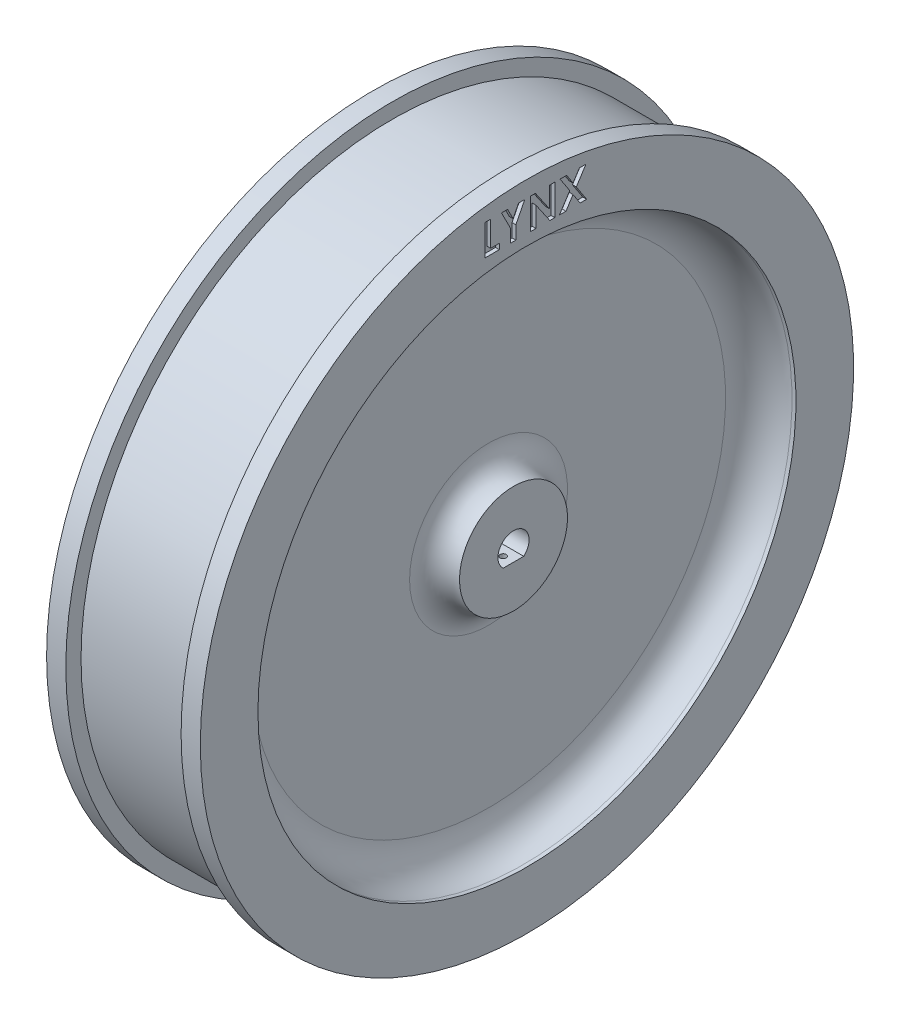
from build123d import *

# Parameters (mm, degrees)
BOSS_EXTRUDE2_DEPTH = 16
CUT_EXTRUDE2_DEPTH  = 1
SKETCH6_R           = 0.8
CUT_EXTRUDE4_DEPTH  = 20


with BuildPart() as part:
    # Sketch1 → Revolve2 (revolve)
    with BuildSketch(Plane.XY):
        with BuildLine():
            Line((8.97393545, 70), (10, 70))
            Line((10, 70), (10, 85))
            Line((10, 85), (5, 85))
            Line((5, 85), (5, 81.038856971))
            Line((5, 81.038856971), (-25, 81.038856971))
            Line((-25, 81.038856971), (-25, 85))
            Line((-25, 85), (-30, 85))
            Line((-30, 85), (-30, 70))
            add(Edge.make_bspline(
                [(-30, 70), (-18.635717154, 58.062094), (-15, 10)],
                knots=[0, 0, 0, 1, 1, 1], degree=2, weights=[1, 2.302666222, 1]))
            Line((-15, 10), (-15, 0))
            Line((-15, 0), (-9.5, 0))
            Line((-9.5, 0), (-9.5, 4.05))
            Line((-9.5, 4.05), (6.5, 4.05))
            Line((6.5, 4.05), (6.5, 14.05))
            Line((6.5, 14.05), (6.49, 14.05))
            ThreePointArc((6.49, 14.05), (1.90087699, 15.95087699), (0, 20.54))
            Line((0, 20.54), (0, 61.684457842))
            ThreePointArc((0, 61.684457842), (2.856751481, 67.601519544), (8.97393545, 70))
        make_face()
    revolve(axis=Axis((0, 0, 0), (1, 0, 0)))

    # Sketch2 → Boss-Extrude2 (add)
    with BuildSketch(Plane(origin=(6.5, 0, 0), x_dir=(0, 0, -1), z_dir=(1, 0, 0))):
        with BuildLine():
            Line((0, -3.05), (-2.664582519, -3.05))
            ThreePointArc((-2.664582519, -3.05), (0, -4.05), (2.664582519, -3.05))
            Line((2.664582519, -3.05), (0, -3.05))
        make_face()
    extrude(amount=-BOSS_EXTRUDE2_DEPTH)

    # Sketch5 → Cut-Extrude2 (cut)
    with BuildSketch(Plane(origin=(10, 0, 0), x_dir=(0, 0, -1), z_dir=(1, 0, 0))):
        Polygon((-10.885951739, 80.726758939), (-9.450054303, 80.726758939), (-9.450054303, 74.162656375), (-7.193644046, 74.162656375), (-7.193644046, 72.726758939), (-10.885951739, 72.726758939), align=None)
        Polygon((-6.629541482, 80.726758939), (-5.031785072, 80.726758939), (-3.603900457, 77.919066632), (-2.172810713, 80.726758939), (-0.578259431, 80.726758939), (-2.885951739, 76.191502529), (-2.885951739, 72.726758939), (-4.321849175, 72.726758939), (-4.321849175, 76.191502529), align=None)
        Polygon((0.908920056, 80.726758939), (2.202189287, 80.726758939), (5.831996979, 75.462335862), (5.831996979, 80.726758939), (7.267894415, 80.726758939), (7.267894415, 72.726758939), (5.9650098, 72.726758939), (2.344817492, 77.975156375), (2.344817492, 72.726758939), (0.908920056, 72.726758939), align=None)
        Polygon((8.62526621, 80.726758939), (10.317573902, 80.726758939), (11.989048261, 78.157848683), (13.663727748, 80.726758939), (15.360843133, 80.726758939), (12.836804672, 76.856566632), (15.524304672, 72.726758939), (13.831996979, 72.726758939), (11.989048261, 75.558489709), (10.142894415, 72.726758939), (8.447381595, 72.726758939), (11.142894415, 76.85977176), align=None)
    extrude(amount=-CUT_EXTRUDE2_DEPTH, mode=Mode.SUBTRACT)

    # Sketch6 → Cut-Extrude4 (cut)
    with BuildSketch(Plane(origin=(0, -3.05, 0), x_dir=(1, 0, 0), z_dir=(0, 1, 0))):
        with Locations((3.805975745, 0)):
            Circle(SKETCH6_R)
    extrude(amount=-CUT_EXTRUDE4_DEPTH, mode=Mode.SUBTRACT)


solid = part.part
